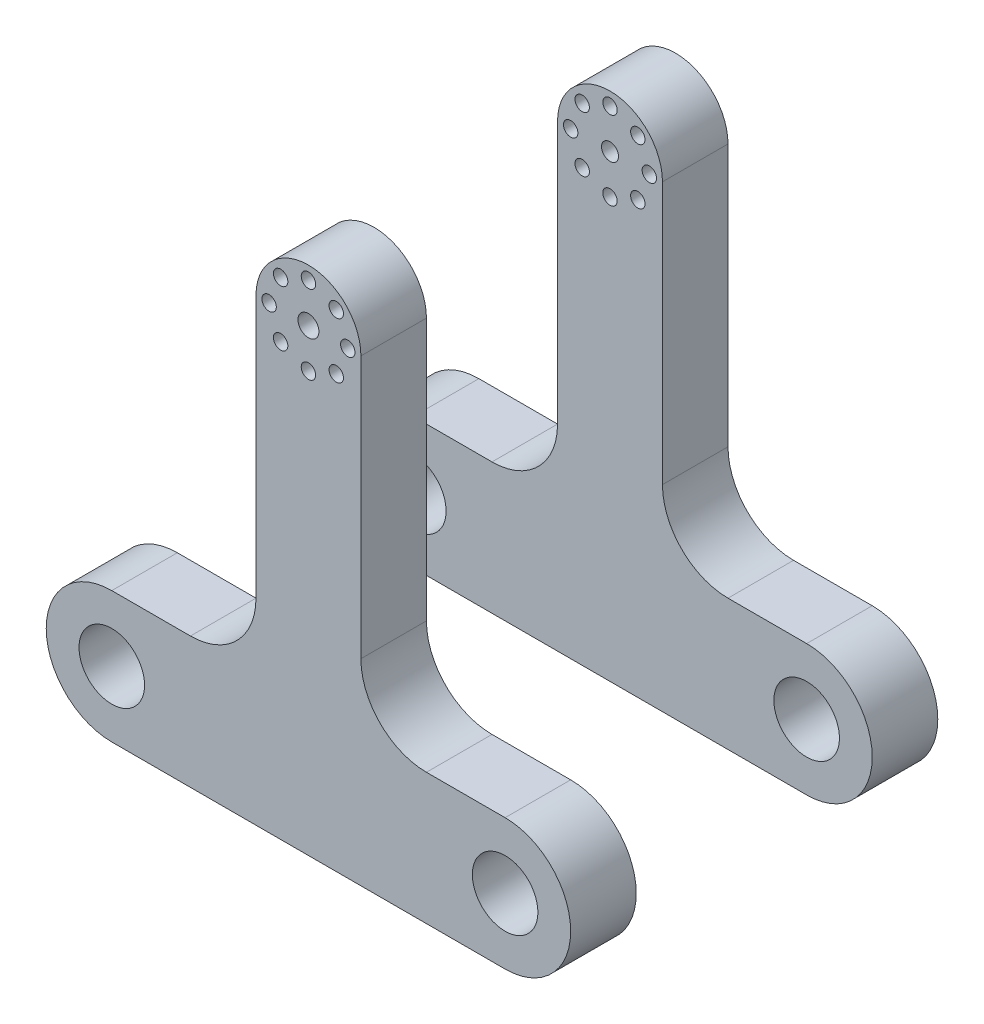
from build123d import *

# Parameters (mm, degrees)
SKETCH_1_R          = 5
SKETCH_1_R_2        = 1.6
EXTRUDE_1_DEPTH     = 10
SKETCH_2_R          = 1.1
CUT_EXTRUDE_1_DEPTH = 80.523581408
SKETCH_4_R          = 5
SKETCH_4_R_2        = 1.1
SKETCH_4_R_3        = 1.3
EXTRUDE_2_DEPTH     = 10


with BuildPart() as part:
    # ｽｹｯﾁ1 → ﾎﾞｽ - 押し出し1 (new body)
    with BuildSketch(Plane.XY):
        with BuildLine():
            Line((-30, 10), (-18, 10))
            ThreePointArc((-18, 10), (-10.928932188, 12.928932188), (-8, 20))
            Line((-8, 20), (-8, 60))
            ThreePointArc((-8, 60), (0, 68), (8, 60))
            Line((8, 60), (8, 20))
            ThreePointArc((8, 20), (10.928932188, 12.928932188), (18, 10))
            Line((18, 10), (30, 10))
            ThreePointArc((30, 10), (40, 0), (30, -10))
            Line((30, -10), (-30, -10))
            ThreePointArc((-30, -10), (-40, 0), (-30, 10))
        make_face()
        with Locations((-30, 0)):
            Circle(SKETCH_1_R, mode=Mode.SUBTRACT)
        with Locations((30, 0)):
            Circle(SKETCH_1_R, mode=Mode.SUBTRACT)
        with Locations((0, 60)):
            Circle(SKETCH_1_R_2, mode=Mode.SUBTRACT)
    extrude(amount=EXTRUDE_1_DEPTH)

    # ｽｹｯﾁ2 → ｶｯﾄ - 押し出し1 (cut, through all)
    with BuildSketch(Plane.XY.offset(10)):
        with Locations((0, 66)):
            Circle(SKETCH_2_R)
        with Locations((4.242640687, 64.242640687)):
            Circle(SKETCH_2_R)
        with Locations((6, 60)):
            Circle(SKETCH_2_R)
        with Locations((4.242640687, 55.757359313)):
            Circle(SKETCH_2_R)
        with Locations((0, 54)):
            Circle(SKETCH_2_R)
        with Locations((-4.242640687, 55.757359313)):
            Circle(SKETCH_2_R)
        with Locations((-6, 60)):
            Circle(SKETCH_2_R)
        with Locations((-4.242640687, 64.242640687)):
            Circle(SKETCH_2_R)
    extrude(amount=-CUT_EXTRUDE_1_DEPTH, mode=Mode.SUBTRACT)


with BuildPart() as body_2:
    # ｽｹｯﾁ4 → ﾎﾞｽ - 押し出し2 (new body)
    with BuildSketch(Plane(origin=(0, 0, -36), x_dir=(-1, 0, 0), z_dir=(0, 0, -1))):
        with BuildLine():
            Line((30, 10), (18, 10))
            ThreePointArc((18, 10), (10.928932188, 12.928932188), (8, 20))
            Line((8, 20), (8, 60))
            ThreePointArc((8, 60), (0, 68), (-8, 60))
            Line((-8, 60), (-8, 20))
            ThreePointArc((-8, 20), (-10.928932188, 12.928932188), (-18, 10))
            Line((-18, 10), (-30, 10))
            ThreePointArc((-30, 10), (-40, 0), (-30, -10))
            Line((-30, -10), (30, -10))
            ThreePointArc((30, -10), (40, 0), (30, 10))
        make_face()
        with Locations((30, 0)):
            Circle(SKETCH_4_R, mode=Mode.SUBTRACT)
        with Locations((-30, 0)):
            Circle(SKETCH_4_R, mode=Mode.SUBTRACT)
        with Locations((-4.242640687, 64.242640687)):
            Circle(SKETCH_4_R_2, mode=Mode.SUBTRACT)
        with Locations((-6, 60)):
            Circle(SKETCH_4_R_2, mode=Mode.SUBTRACT)
        with Locations((-4.242640687, 55.757359313)):
            Circle(SKETCH_4_R_2, mode=Mode.SUBTRACT)
        with Locations((0, 54)):
            Circle(SKETCH_4_R_2, mode=Mode.SUBTRACT)
        with Locations((4.242640687, 55.757359313)):
            Circle(SKETCH_4_R_2, mode=Mode.SUBTRACT)
        with Locations((6, 60)):
            Circle(SKETCH_4_R_2, mode=Mode.SUBTRACT)
        with Locations((4.242640687, 64.242640687)):
            Circle(SKETCH_4_R_2, mode=Mode.SUBTRACT)
        with Locations((0, 66)):
            Circle(SKETCH_4_R_2, mode=Mode.SUBTRACT)
        with Locations((0, 60)):
            Circle(SKETCH_4_R_3, mode=Mode.SUBTRACT)
    extrude(amount=EXTRUDE_2_DEPTH)


solid = Compound([part.part, body_2.part])
